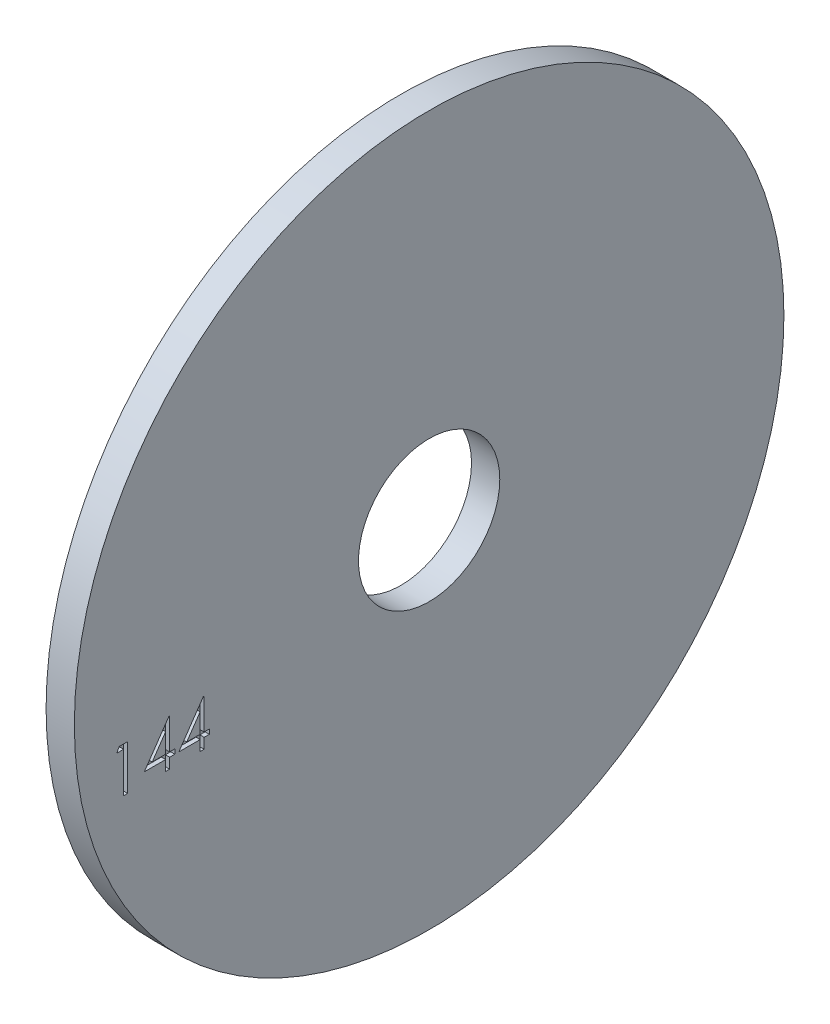
from build123d import *

# Parameters (mm, degrees)
SKETCH1_R           = 25.11
SKETCH1_R_2         = 5
BOSS_EXTRUDE1_DEPTH = 2
CUT_EXTRUDE2_DEPTH  = 0.3


with BuildPart() as part:
    # Sketch1 → Boss-Extrude1 (new body)
    with BuildSketch(Plane(origin=(0, 0, 0), x_dir=(0, 0, -1), z_dir=(1, 0, 0))):
        Circle(SKETCH1_R)
        Circle(SKETCH1_R_2, mode=Mode.SUBTRACT)
    extrude(amount=BOSS_EXTRUDE1_DEPTH)

    # Sketch3 → Cut-Extrude2 (cut)
    # profile 1 of 3: a face of its own
    with BuildSketch(Plane(origin=(2, 0, 0), x_dir=(0, 0, -1), z_dir=(1, 0, 0))):
        Polygon((-21.924071507, -2.903864462), (-21.337027236, -2.903864462), (-21.337027236, -6.078864462), (-21.621963134, -6.078864462), (-21.621963134, -3.229505488), (-22.110424672, -3.229505488), align=None)
    # profile 2 of 3: a face of its own
    with BuildSketch(Plane(origin=(2, 0, 0), x_dir=(0, 0, -1), z_dir=(1, 0, 0))):
        Polygon((-18.423430481, -2.822454205), (-18.365552877, -2.822454205), (-18.365552877, -5.020531129), (-17.999206723, -5.020531129), (-17.999206723, -5.346172154), (-18.365552877, -5.346172154), (-18.365552877, -6.078864462), (-18.650488775, -6.078864462), (-18.650488775, -5.346172154), (-20.156578518, -5.346172154), align=None)
        Polygon((-18.650488775, -5.020531129), (-18.650488775, -3.641644911), (-19.596883005, -5.020531129), align=None, mode=Mode.SUBTRACT)
    # profile 3 of 3: a face of its own
    with BuildSketch(Plane(origin=(2, 0, 0), x_dir=(0, 0, -1), z_dir=(1, 0, 0))):
        Polygon((-15.981122789, -2.822454205), (-15.923245185, -2.822454205), (-15.923245185, -5.020531129), (-15.556899031, -5.020531129), (-15.556899031, -5.346172154), (-15.923245185, -5.346172154), (-15.923245185, -6.078864462), (-16.208181082, -6.078864462), (-16.208181082, -5.346172154), (-17.714270826, -5.346172154), align=None)
        Polygon((-16.208181082, -5.020531129), (-16.208181082, -3.641644911), (-17.154575313, -5.020531129), align=None, mode=Mode.SUBTRACT)
    extrude(amount=-CUT_EXTRUDE2_DEPTH, mode=Mode.SUBTRACT)


solid = part.part
